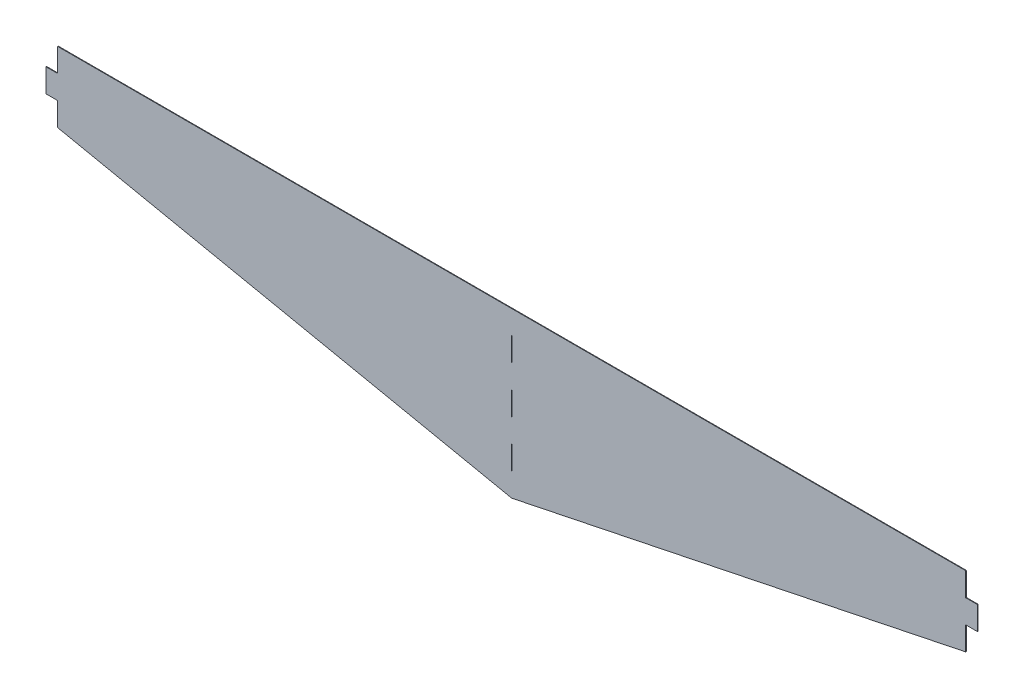
from build123d import *

# Parameters (mm, degrees)
BOSS_EXTRUDE1_DEPTH  = 0.125
SKETCH2_W            = 0.3
SKETCH2_H            = 10
CUT_EXTRUDE1_DEPTH   = 211.481145236
LPATTERN1_COUNT      = 3
LPATTERN1_PITCH      = 20
SKETCH3_W            = 5
SKETCH3_H            = 10
CUT_EXTRUDE2_DEPTH   = 211.481145236
LPATTERN2_COUNT      = 3
LPATTERN2_PITCH      = 20
LPATTERN2_COUNT_DIR2 = 2
LPATTERN2_PITCH_DIR2 = 392


with BuildPart() as part:
    # Sketch1 → Boss-Extrude1 (new, symmetric)
    with BuildSketch(Plane.XY):
        Polygon((0, 0), (193.5, 40), (198.5, 40), (198.5, 70), (193.5, 70), (-193.5, 70), (-198.5, 70), (-198.5, 40), (-193.5, 40), align=None)
    extrude(amount=BOSS_EXTRUDE1_DEPTH, both=True)

    # Sketch2 → Cut-Extrude1 (cut, through all)
    with BuildSketch(Plane.XY.offset(0.125)):
        with Locations((0, 55)):
            Rectangle(SKETCH2_W, SKETCH2_H)
    cut_extrude1 = extrude(amount=-CUT_EXTRUDE1_DEPTH, mode=Mode.SUBTRACT)

    # LPattern1: Cut-Extrude1 ×3
    with Locations(*[(0, -i * LPATTERN1_PITCH, 0) for i in range(1, LPATTERN1_COUNT)]):
        add(cut_extrude1, mode=Mode.SUBTRACT)

    # Sketch3 → Cut-Extrude2 (cut, through all)
    with BuildSketch(Plane.XY.offset(0.125)):
        with Locations((-196, 65)):
            Rectangle(SKETCH3_W, SKETCH3_H)
    cut_extrude2 = extrude(amount=-CUT_EXTRUDE2_DEPTH, mode=Mode.SUBTRACT)

    # LPattern2: Cut-Extrude2 3 × 2
    with Locations(*[(j * LPATTERN2_PITCH_DIR2, -i * LPATTERN2_PITCH, 0) for i in range(LPATTERN2_COUNT) for j in range(LPATTERN2_COUNT_DIR2) if (i, j) != (0, 0)]):
        add(cut_extrude2, mode=Mode.SUBTRACT)


solid = part.part
